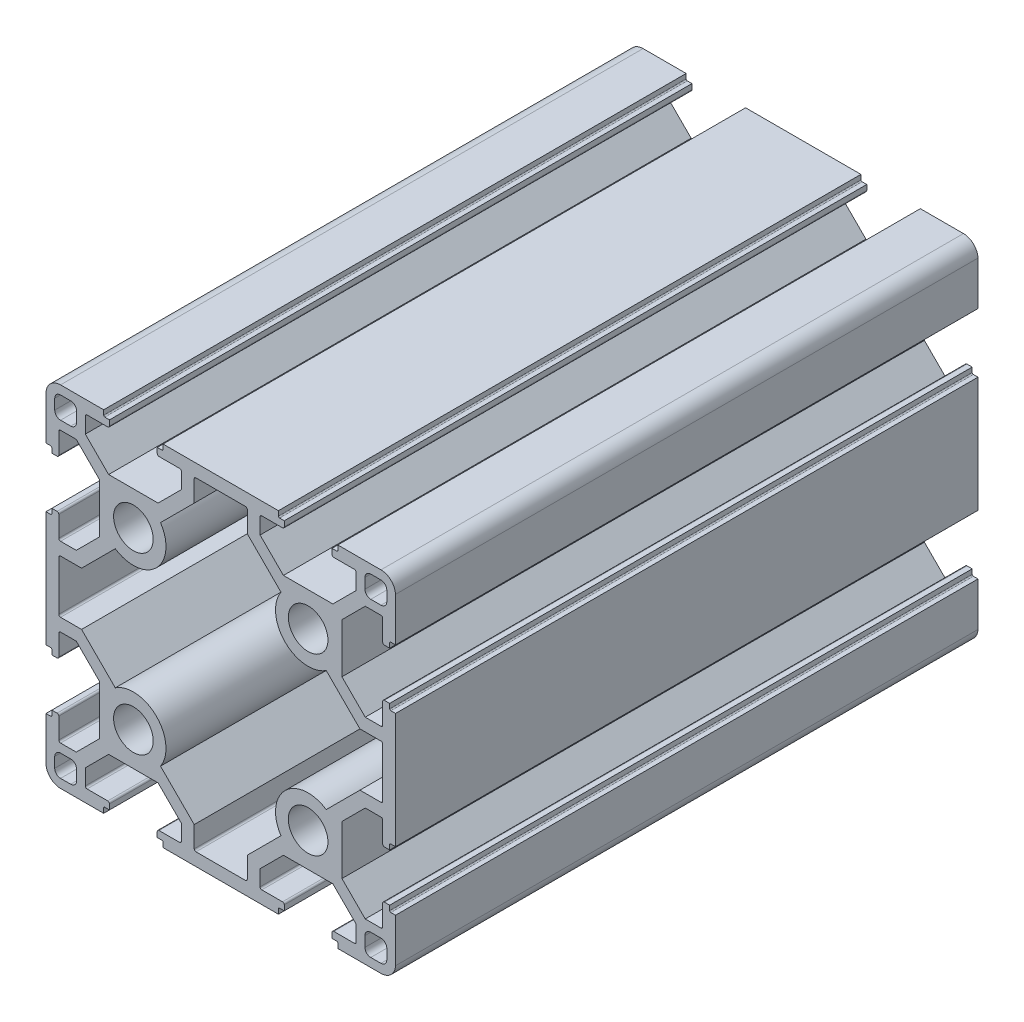
from build123d import *

# Parameters (mm, degrees)
SKETCH_1_R      = 3.4
EXTRUDE_1_DEPTH = 100


with BuildPart() as part:
    # 草图1 → 凸台-拉伸1 (new body)
    with BuildSketch(Plane.XY):
        with BuildLine():
            Line((21.591563969, 19.808149806), (25.597198888, 23.813784725))
            Line((25.597198888, 23.813784725), (28.291563969, 23.813784725))
            ThreePointArc((28.291563969, 23.813784725), (28.503696004, 23.725916759), (28.591563969, 23.513784725))
            Line((28.591563969, 23.513784725), (28.591563969, 19.963784725))
            ThreePointArc((28.591563969, 19.963784725), (28.679431935, 19.751652691), (28.891563969, 19.663784725))
            Line((28.891563969, 19.663784725), (29.791563969, 19.663784725))
            Line((29.791563969, 19.663784725), (29.791563969, 20.463784725))
            ThreePointArc((29.791563969, 20.463784725), (29.850142613, 20.605206081), (29.991563969, 20.663784725))
            Line((29.991563969, 20.663784725), (30.789298615, 20.663784725))
            Line((30.789298615, 20.663784725), (30.789298615, 28.170187919))
            ThreePointArc((30.789298615, 28.170187919), (30.02130268, 29.868778906), (28.291563969, 30.563784725))
            Line((28.291563969, 30.563784725), (20.891563969, 30.563784725))
            Line((20.891563969, 30.563784725), (20.891563969, 29.763784725))
            ThreePointArc((20.891563969, 29.763784725), (20.832985326, 29.622363369), (20.691563969, 29.563784725))
            Line((20.691563969, 29.563784725), (19.891563969, 29.563784725))
            Line((19.891563969, 29.563784725), (19.891563969, 28.663784725))
            ThreePointArc((19.891563969, 28.663784725), (19.979431935, 28.451652691), (20.191563969, 28.363784725))
            Line((20.191563969, 28.363784725), (23.741563969, 28.363784725))
            ThreePointArc((23.741563969, 28.363784725), (23.953696004, 28.275916759), (24.041563969, 28.063784725))
            Line((24.041563969, 28.063784725), (24.041563969, 25.369419644))
            Line((24.041563969, 25.369419644), (20.035929051, 21.363784725))
            Line((20.035929051, 21.363784725), (11.547198888, 21.363784725))
            Line((11.547198888, 21.363784725), (7.541563969, 25.369419644))
            Line((7.541563969, 25.369419644), (7.541563969, 28.063784725))
            ThreePointArc((7.541563969, 28.063784725), (7.629431935, 28.275916759), (7.841563969, 28.363784725))
            Line((7.841563969, 28.363784725), (11.391563969, 28.363784725))
            ThreePointArc((11.391563969, 28.363784725), (11.603696004, 28.451652691), (11.691563969, 28.663784725))
            Line((11.691563969, 28.663784725), (11.691563969, 29.563784725))
            Line((11.691563969, 29.563784725), (10.891563969, 29.563784725))
            ThreePointArc((10.891563969, 29.563784725), (10.750142613, 29.622363369), (10.691563969, 29.763784725))
            Line((10.691563969, 29.763784725), (10.691563969, 30.563784725))
            Line((10.691563969, 30.563784725), (3.291563969, 30.563784725))
            Line((3.291563969, 30.563784725), (0.789298615, 30.563784725))
            Line((0.789298615, 30.563784725), (-9.112966739, 30.563784725))
            Line((-9.112966739, 30.563784725), (-9.112966739, 29.763784725))
            ThreePointArc((-9.112966739, 29.763784725), (-9.171545383, 29.622363369), (-9.312966739, 29.563784725))
            Line((-9.312966739, 29.563784725), (-10.112966739, 29.563784725))
            Line((-10.112966739, 29.563784725), (-10.112966739, 28.663784725))
            ThreePointArc((-10.112966739, 28.663784725), (-10.025098774, 28.451652691), (-9.812966739, 28.363784725))
            Line((-9.812966739, 28.363784725), (-6.262966739, 28.363784725))
            ThreePointArc((-6.262966739, 28.363784725), (-6.050834705, 28.275916759), (-5.962966739, 28.063784725))
            Line((-5.962966739, 28.063784725), (-5.962966739, 25.369419644))
            Line((-5.962966739, 25.369419644), (-9.968601658, 21.363784725))
            Line((-9.968601658, 21.363784725), (-18.457331821, 21.363784725))
            Line((-18.457331821, 21.363784725), (-22.462966739, 25.369419644))
            Line((-22.462966739, 25.369419644), (-22.462966739, 28.063784725))
            ThreePointArc((-22.462966739, 28.063784725), (-22.375098774, 28.275916759), (-22.162966739, 28.363784725))
            Line((-22.162966739, 28.363784725), (-18.612966739, 28.363784725))
            ThreePointArc((-18.612966739, 28.363784725), (-18.400834705, 28.451652691), (-18.312966739, 28.663784725))
            Line((-18.312966739, 28.663784725), (-18.312966739, 29.563784725))
            Line((-18.312966739, 29.563784725), (-19.112966739, 29.563784725))
            ThreePointArc((-19.112966739, 29.563784725), (-19.254388095, 29.622363369), (-19.312966739, 29.763784725))
            Line((-19.312966739, 29.763784725), (-19.312966739, 30.563784725))
            Line((-19.312966739, 30.563784725), (-26.712966739, 30.563784725))
            ThreePointArc((-26.712966739, 30.563784725), (-28.44270545, 29.868778906), (-29.210701385, 28.170187919))
            Line((-29.210701385, 28.170187919), (-29.210701385, 20.663784725))
            Line((-29.210701385, 20.663784725), (-28.412966739, 20.663784725))
            ThreePointArc((-28.412966739, 20.663784725), (-28.271545383, 20.605206081), (-28.212966739, 20.463784725))
            Line((-28.212966739, 20.463784725), (-28.212966739, 19.663784725))
            Line((-28.212966739, 19.663784725), (-27.312966739, 19.663784725))
            ThreePointArc((-27.312966739, 19.663784725), (-27.100834705, 19.751652691), (-27.012966739, 19.963784725))
            Line((-27.012966739, 19.963784725), (-27.012966739, 23.513784725))
            ThreePointArc((-27.012966739, 23.513784725), (-26.925098774, 23.725916759), (-26.712966739, 23.813784725))
            Line((-26.712966739, 23.813784725), (-24.018601658, 23.813784725))
            Line((-24.018601658, 23.813784725), (-20.012966739, 19.808149806))
            Line((-20.012966739, 19.808149806), (-20.012966739, 11.319419644))
            Line((-20.012966739, 11.319419644), (-24.018601658, 7.313784725))
            Line((-24.018601658, 7.313784725), (-26.712966739, 7.313784725))
            ThreePointArc((-26.712966739, 7.313784725), (-26.925098774, 7.401652691), (-27.012966739, 7.613784725))
            Line((-27.012966739, 7.613784725), (-27.012966739, 11.163784725))
            ThreePointArc((-27.012966739, 11.163784725), (-27.100834705, 11.375916759), (-27.312966739, 11.463784725))
            Line((-27.312966739, 11.463784725), (-28.212966739, 11.463784725))
            Line((-28.212966739, 11.463784725), (-28.212966739, 10.663784725))
            ThreePointArc((-28.212966739, 10.663784725), (-28.271545383, 10.522363369), (-28.412966739, 10.463784725))
            Line((-28.412966739, 10.463784725), (-29.210701385, 10.463784725))
            Line((-29.210701385, 10.463784725), (-29.210701385, -9.336215275))
            Line((-29.210701385, -9.336215275), (-28.412966739, -9.336215275))
            ThreePointArc((-28.412966739, -9.336215275), (-28.271545383, -9.394793919), (-28.212966739, -9.536215275))
            Line((-28.212966739, -9.536215275), (-28.212966739, -10.336215275))
            Line((-28.212966739, -10.336215275), (-27.312966739, -10.336215275))
            ThreePointArc((-27.312966739, -10.336215275), (-27.100834705, -10.248347309), (-27.012966739, -10.036215275))
            Line((-27.012966739, -10.036215275), (-27.012966739, -6.486215275))
            ThreePointArc((-27.012966739, -6.486215275), (-26.925098774, -6.274083241), (-26.712966739, -6.186215275))
            Line((-26.712966739, -6.186215275), (-24.018601658, -6.186215275))
            Line((-24.018601658, -6.186215275), (-20.012966739, -10.191850194))
            Line((-20.012966739, -10.191850194), (-20.012966739, -18.680580356))
            Line((-20.012966739, -18.680580356), (-24.018601658, -22.686215275))
            Line((-24.018601658, -22.686215275), (-26.712966739, -22.686215275))
            ThreePointArc((-26.712966739, -22.686215275), (-26.925098774, -22.598347309), (-27.012966739, -22.386215275))
            Line((-27.012966739, -22.386215275), (-27.012966739, -18.836215275))
            ThreePointArc((-27.012966739, -18.836215275), (-27.100834705, -18.624083241), (-27.312966739, -18.536215275))
            Line((-27.312966739, -18.536215275), (-28.212966739, -18.536215275))
            Line((-28.212966739, -18.536215275), (-28.212966739, -19.336215275))
            ThreePointArc((-28.212966739, -19.336215275), (-28.271545383, -19.477636631), (-28.412966739, -19.536215275))
            Line((-28.412966739, -19.536215275), (-29.210701385, -19.536215275))
            Line((-29.210701385, -19.536215275), (-29.210701385, -27.042618468))
            ThreePointArc((-29.210701385, -27.042618468), (-28.44270545, -28.741209455), (-26.712966739, -29.436215275))
            Line((-26.712966739, -29.436215275), (-19.312966739, -29.436215275))
            Line((-19.312966739, -29.436215275), (-19.312966739, -28.636215275))
            ThreePointArc((-19.312966739, -28.636215275), (-19.254388095, -28.494793919), (-19.112966739, -28.436215275))
            Line((-19.112966739, -28.436215275), (-18.312966739, -28.436215275))
            Line((-18.312966739, -28.436215275), (-18.312966739, -27.536215275))
            ThreePointArc((-18.312966739, -27.536215275), (-18.400834705, -27.324083241), (-18.612966739, -27.236215275))
            Line((-18.612966739, -27.236215275), (-22.162966739, -27.236215275))
            ThreePointArc((-22.162966739, -27.236215275), (-22.375098774, -27.148347309), (-22.462966739, -26.936215275))
            Line((-22.462966739, -26.936215275), (-22.462966739, -24.241850194))
            Line((-22.462966739, -24.241850194), (-18.457331821, -20.236215275))
            Line((-18.457331821, -20.236215275), (-9.968601658, -20.236215275))
            Line((-9.968601658, -20.236215275), (-5.962966739, -24.241850194))
            Line((-5.962966739, -24.241850194), (-5.962966739, -26.936215275))
            ThreePointArc((-5.962966739, -26.936215275), (-6.050834705, -27.148347309), (-6.262966739, -27.236215275))
            Line((-6.262966739, -27.236215275), (-9.812966739, -27.236215275))
            ThreePointArc((-9.812966739, -27.236215275), (-10.025098774, -27.324083241), (-10.112966739, -27.536215275))
            Line((-10.112966739, -27.536215275), (-10.112966739, -28.436215275))
            Line((-10.112966739, -28.436215275), (-9.312966739, -28.436215275))
            ThreePointArc((-9.312966739, -28.436215275), (-9.171545383, -28.494793919), (-9.112966739, -28.636215275))
            Line((-9.112966739, -28.636215275), (-9.112966739, -29.436215275))
            Line((-9.112966739, -29.436215275), (-1.712966739, -29.436215275))
            Line((-1.712966739, -29.436215275), (0.789298615, -29.436215275))
            Line((0.789298615, -29.436215275), (10.691563969, -29.436215275))
            Line((10.691563969, -29.436215275), (10.691563969, -28.636215275))
            ThreePointArc((10.691563969, -28.636215275), (10.750142613, -28.494793919), (10.891563969, -28.436215275))
            Line((10.891563969, -28.436215275), (11.691563969, -28.436215275))
            Line((11.691563969, -28.436215275), (11.691563969, -27.536215275))
            ThreePointArc((11.691563969, -27.536215275), (11.603696004, -27.324083241), (11.391563969, -27.236215275))
            Line((11.391563969, -27.236215275), (7.841563969, -27.236215275))
            ThreePointArc((7.841563969, -27.236215275), (7.629431935, -27.148347309), (7.541563969, -26.936215275))
            Line((7.541563969, -26.936215275), (7.541563969, -24.241850194))
            Line((7.541563969, -24.241850194), (11.547198888, -20.236215275))
            Line((11.547198888, -20.236215275), (20.035929051, -20.236215275))
            Line((20.035929051, -20.236215275), (24.041563969, -24.241850194))
            Line((24.041563969, -24.241850194), (24.041563969, -26.936215275))
            ThreePointArc((24.041563969, -26.936215275), (23.953696004, -27.148347309), (23.741563969, -27.236215275))
            Line((23.741563969, -27.236215275), (20.191563969, -27.236215275))
            ThreePointArc((20.191563969, -27.236215275), (19.979431935, -27.324083241), (19.891563969, -27.536215275))
            Line((19.891563969, -27.536215275), (19.891563969, -28.436215275))
            Line((19.891563969, -28.436215275), (20.691563969, -28.436215275))
            ThreePointArc((20.691563969, -28.436215275), (20.832985326, -28.494793919), (20.891563969, -28.636215275))
            Line((20.891563969, -28.636215275), (20.891563969, -29.436215275))
            Line((20.891563969, -29.436215275), (28.291563969, -29.436215275))
            ThreePointArc((28.291563969, -29.436215275), (30.02130268, -28.741209455), (30.789298615, -27.042618468))
            Line((30.789298615, -27.042618468), (30.789298615, -19.536215275))
            Line((30.789298615, -19.536215275), (29.991563969, -19.536215275))
            ThreePointArc((29.991563969, -19.536215275), (29.850142613, -19.477636631), (29.791563969, -19.336215275))
            Line((29.791563969, -19.336215275), (29.791563969, -18.536215275))
            Line((29.791563969, -18.536215275), (28.891563969, -18.536215275))
            ThreePointArc((28.891563969, -18.536215275), (28.679431935, -18.624083241), (28.591563969, -18.836215275))
            Line((28.591563969, -18.836215275), (28.591563969, -22.386215275))
            ThreePointArc((28.591563969, -22.386215275), (28.503696004, -22.598347309), (28.291563969, -22.686215275))
            Line((28.291563969, -22.686215275), (25.597198888, -22.686215275))
            Line((25.597198888, -22.686215275), (21.591563969, -18.680580356))
            Line((21.591563969, -18.680580356), (21.591563969, -10.191850194))
            Line((21.591563969, -10.191850194), (25.597198888, -6.186215275))
            Line((25.597198888, -6.186215275), (28.291563969, -6.186215275))
            ThreePointArc((28.291563969, -6.186215275), (28.503696004, -6.274083241), (28.591563969, -6.486215275))
            Line((28.591563969, -6.486215275), (28.591563969, -10.036215275))
            ThreePointArc((28.591563969, -10.036215275), (28.679431935, -10.248347309), (28.891563969, -10.336215275))
            Line((28.891563969, -10.336215275), (29.791563969, -10.336215275))
            Line((29.791563969, -10.336215275), (29.791563969, -9.536215275))
            ThreePointArc((29.791563969, -9.536215275), (29.850142613, -9.394793919), (29.991563969, -9.336215275))
            Line((29.991563969, -9.336215275), (30.789298615, -9.336215275))
            Line((30.789298615, -9.336215275), (30.789298615, 0.563784725))
            Line((30.789298615, 0.563784725), (30.789298615, 10.463784725))
            Line((30.789298615, 10.463784725), (29.991563969, 10.463784725))
            ThreePointArc((29.991563969, 10.463784725), (29.850142613, 10.522363369), (29.791563969, 10.663784725))
            Line((29.791563969, 10.663784725), (29.791563969, 11.463784725))
            Line((29.791563969, 11.463784725), (28.891563969, 11.463784725))
            ThreePointArc((28.891563969, 11.463784725), (28.679431935, 11.375916759), (28.591563969, 11.163784725))
            Line((28.591563969, 11.163784725), (28.591563969, 7.613784725))
            ThreePointArc((28.591563969, 7.613784725), (28.503696004, 7.401652691), (28.291563969, 7.313784725))
            Line((28.291563969, 7.313784725), (25.597198888, 7.313784725))
            Line((25.597198888, 7.313784725), (21.591563969, 11.319419644))
            Line((21.591563969, 11.319419644), (21.591563969, 19.808149806))
        make_face()
        with Locations((15.789298615, -14.436215275)):
            Circle(SKETCH_1_R, mode=Mode.SUBTRACT)
        with Locations((-14.210701385, -14.436215275)):
            Circle(SKETCH_1_R, mode=Mode.SUBTRACT)
        with Locations((15.789298615, 15.563784725)):
            Circle(SKETCH_1_R, mode=Mode.SUBTRACT)
        with Locations((-14.210701385, 15.563784725)):
            Circle(SKETCH_1_R, mode=Mode.SUBTRACT)
        with BuildLine():
            Line((26.541563969, -24.186215275), (28.291563969, -24.186215275))
            ThreePointArc((28.291563969, -24.186215275), (28.998670751, -24.479108494), (29.291563969, -25.186215275))
            Line((29.291563969, -25.186215275), (29.291563969, -26.936215275))
            ThreePointArc((29.291563969, -26.936215275), (28.998670751, -27.643322056), (28.291563969, -27.936215275))
            Line((28.291563969, -27.936215275), (26.541563969, -27.936215275))
            ThreePointArc((26.541563969, -27.936215275), (25.834457188, -27.643322056), (25.541563969, -26.936215275))
            Line((25.541563969, -26.936215275), (25.541563969, -25.186215275))
            ThreePointArc((25.541563969, -25.186215275), (25.834457188, -24.479108494), (26.541563969, -24.186215275))
        make_face(mode=Mode.SUBTRACT)
        with BuildLine():
            Line((-23.962966739, -25.186215275), (-23.962966739, -26.936215275))
            ThreePointArc((-23.962966739, -26.936215275), (-24.255859958, -27.643322056), (-24.962966739, -27.936215275))
            Line((-24.962966739, -27.936215275), (-26.712966739, -27.936215275))
            ThreePointArc((-26.712966739, -27.936215275), (-27.42007352, -27.643322056), (-27.712966739, -26.936215275))
            Line((-27.712966739, -26.936215275), (-27.712966739, -25.186215275))
            ThreePointArc((-27.712966739, -25.186215275), (-27.42007352, -24.479108494), (-26.712966739, -24.186215275))
            Line((-26.712966739, -24.186215275), (-24.962966739, -24.186215275))
            ThreePointArc((-24.962966739, -24.186215275), (-24.255859958, -24.479108494), (-23.962966739, -25.186215275))
        make_face(mode=Mode.SUBTRACT)
        with BuildLine():
            Line((25.541563969, 26.313784725), (25.541563969, 28.063784725))
            ThreePointArc((25.541563969, 28.063784725), (25.834457188, 28.770891506), (26.541563969, 29.063784725))
            Line((26.541563969, 29.063784725), (28.291563969, 29.063784725))
            ThreePointArc((28.291563969, 29.063784725), (28.998670751, 28.770891506), (29.291563969, 28.063784725))
            Line((29.291563969, 28.063784725), (29.291563969, 26.313784725))
            ThreePointArc((29.291563969, 26.313784725), (28.998670751, 25.606677944), (28.291563969, 25.313784725))
            Line((28.291563969, 25.313784725), (26.541563969, 25.313784725))
            ThreePointArc((26.541563969, 25.313784725), (25.834457188, 25.606677944), (25.541563969, 26.313784725))
        make_face(mode=Mode.SUBTRACT)
        with BuildLine():
            Line((-24.962966739, 25.313784725), (-26.712966739, 25.313784725))
            ThreePointArc((-26.712966739, 25.313784725), (-27.42007352, 25.606677944), (-27.712966739, 26.313784725))
            Line((-27.712966739, 26.313784725), (-27.712966739, 28.063784725))
            ThreePointArc((-27.712966739, 28.063784725), (-27.42007352, 28.770891506), (-26.712966739, 29.063784725))
            Line((-26.712966739, 29.063784725), (-24.962966739, 29.063784725))
            ThreePointArc((-24.962966739, 29.063784725), (-24.255859958, 28.770891506), (-23.962966739, 28.063784725))
            Line((-23.962966739, 28.063784725), (-23.962966739, 26.313784725))
            ThreePointArc((-23.962966739, 26.313784725), (-24.255859958, 25.606677944), (-24.962966739, 25.313784725))
        make_face(mode=Mode.SUBTRACT)
        with BuildLine():
            Line((-9.551136132, 18.669980414), (-3.762966739, 24.458149806))
            Line((-3.762966739, 24.458149806), (-3.762966739, 28.063784725))
            ThreePointArc((-3.762966739, 28.063784725), (-3.675098774, 28.275916759), (-3.462966739, 28.363784725))
            Line((-3.462966739, 28.363784725), (0.789298615, 28.363784725))
            Line((0.789298615, 28.363784725), (5.041563969, 28.363784725))
            ThreePointArc((5.041563969, 28.363784725), (5.253696004, 28.275916759), (5.341563969, 28.063784725))
            Line((5.341563969, 28.063784725), (5.341563969, 24.458149806))
            Line((5.341563969, 24.458149806), (11.129733362, 18.669980414))
            ThreePointArc((11.129733362, 18.669980414), (11.82950064, 11.60398675), (18.895494304, 10.904219472))
            Line((18.895494304, 10.904219472), (24.683663696, 5.116050079))
            Line((24.683663696, 5.116050079), (28.289298615, 5.116050079))
            ThreePointArc((28.289298615, 5.116050079), (28.501430649, 5.028182114), (28.589298615, 4.816050079))
            Line((28.589298615, 4.816050079), (28.589298615, 0.563784725))
            Line((28.589298615, 0.563784725), (28.589298615, -3.688480629))
            ThreePointArc((28.589298615, -3.688480629), (28.501430649, -3.900612664), (28.289298615, -3.988480629))
            Line((28.289298615, -3.988480629), (24.683663696, -3.988480629))
            Line((24.683663696, -3.988480629), (18.895494304, -9.776650022))
            ThreePointArc((18.895494304, -9.776650022), (11.82950064, -10.4764173), (11.129733362, -17.542410963))
            Line((11.129733362, -17.542410963), (5.341563969, -23.330580356))
            Line((5.341563969, -23.330580356), (5.341563969, -26.936215275))
            ThreePointArc((5.341563969, -26.936215275), (5.253696004, -27.148347309), (5.041563969, -27.236215275))
            Line((5.041563969, -27.236215275), (0.789298615, -27.236215275))
            Line((0.789298615, -27.236215275), (-3.462966739, -27.236215275))
            ThreePointArc((-3.462966739, -27.236215275), (-3.675098774, -27.148347309), (-3.762966739, -26.936215275))
            Line((-3.762966739, -26.936215275), (-3.762966739, -23.330580356))
            Line((-3.762966739, -23.330580356), (-9.551136132, -17.542410963))
            ThreePointArc((-9.551136132, -17.542410963), (-10.25090341, -10.4764173), (-17.316897073, -9.776650022))
            Line((-17.316897073, -9.776650022), (-23.105066466, -3.988480629))
            Line((-23.105066466, -3.988480629), (-26.710701385, -3.988480629))
            ThreePointArc((-26.710701385, -3.988480629), (-26.922833419, -3.900612664), (-27.010701385, -3.688480629))
            Line((-27.010701385, -3.688480629), (-27.010701385, 4.816050079))
            ThreePointArc((-27.010701385, 4.816050079), (-26.922833419, 5.028182114), (-26.710701385, 5.116050079))
            Line((-26.710701385, 5.116050079), (-23.105066466, 5.116050079))
            Line((-23.105066466, 5.116050079), (-17.316897073, 10.904219472))
            ThreePointArc((-17.316897073, 10.904219472), (-10.25090341, 11.60398675), (-9.551136132, 18.669980414))
        make_face(mode=Mode.SUBTRACT)
    extrude(amount=EXTRUDE_1_DEPTH)


solid = part.part
